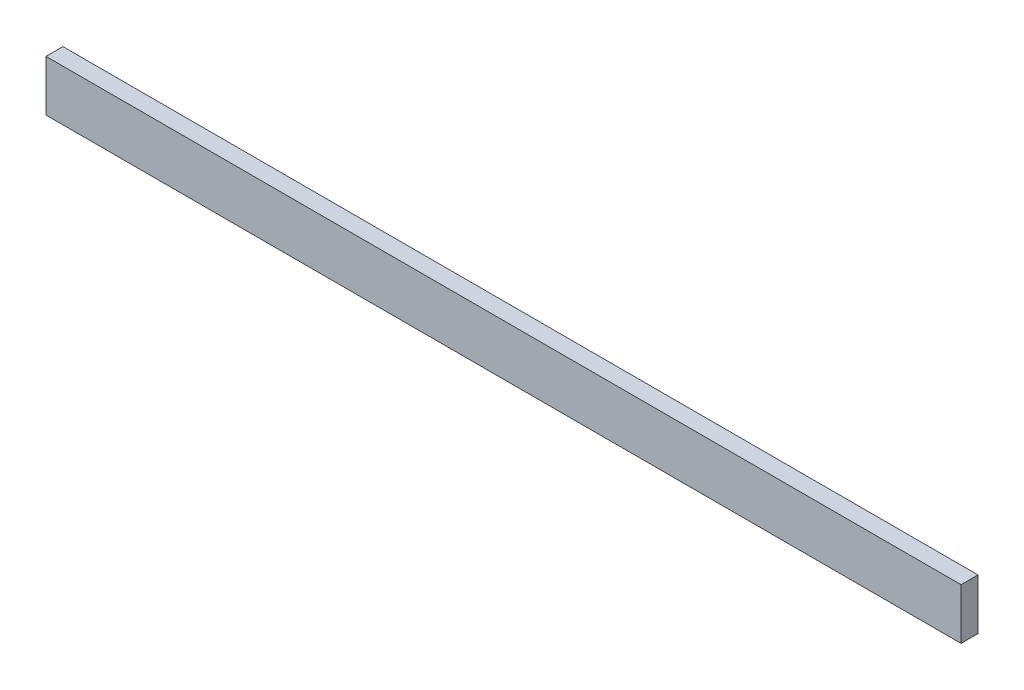
from build123d import *

# Parameters (mm, degrees)
SKETCH_1_W      = 54
SKETCH_1_H      = 3
EXTRUDE_1_DEPTH = 1


with BuildPart() as part:
    # 草图1 → 拉伸-薄壁1 (new body)
    with BuildSketch(Plane.XY):
        with Locations((27, -1.5)):
            Rectangle(SKETCH_1_W, SKETCH_1_H)
    extrude(amount=EXTRUDE_1_DEPTH)


solid = part.part
